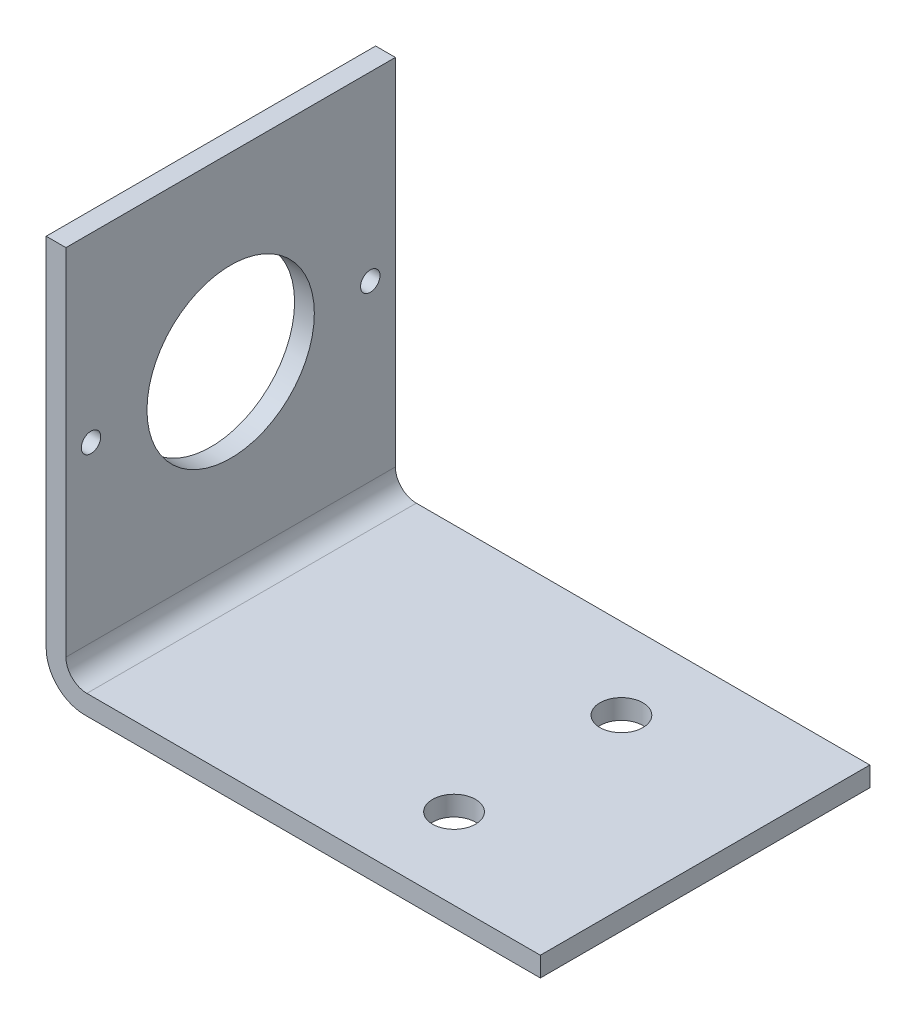
from build123d import *

# Parameters (mm, degrees)
BOSS_EXTRUDE1_DEPTH       = 50
SKETCH5_R                 = 3.2639
MOUNTING_HORIZONTAL_DEPTH = 107.647674169
SKETCH7_R                 = 12.7
BEARING_WITH_MOTOR_DEPTH  = 109.279157861
SKETCH8_R                 = 1.4732
F_4_40_WITH_MOTOR_DEPTH   = 109.279157861


with BuildPart() as part:
    # Sketch2 → Boss-Extrude1 (new body)
    with BuildSketch(Plane.XY):
        with BuildLine():
            Line((0, 5.842), (0, 59.9948))
            Line((0, 59.9948), (2.9972, 59.9948))
            Line((2.9972, 59.9948), (2.9972, 6.1722))
            ThreePointArc((2.9972, 6.1722), (3.92713597, 3.92713597), (6.1722, 2.9972))
            Line((6.1722, 2.9972), (75, 2.9972))
            Line((75, 2.9972), (75, 0))
            Line((75, 0), (5.842, 0))
            ThreePointArc((5.842, 0), (1.711082184, 1.711082184), (0, 5.842))
        make_face()
    extrude(amount=BOSS_EXTRUDE1_DEPTH)

    # Sketch5 → Mounting -- Horizontal (cut, through all)
    with BuildSketch(Plane(origin=(0, 2.9972, 0), x_dir=(1, 0, 0), z_dir=(0, 1, 0))):
        with Locations(Location((49.6, -12.3, 0), (0, 0, 270))):
            Circle(SKETCH5_R)
        with Locations(Location((49.6, -37.7, 0), (0, 0, 270))):
            Circle(SKETCH5_R)
    extrude(amount=-MOUNTING_HORIZONTAL_DEPTH, mode=Mode.SUBTRACT)

    # Sketch7 → Bearing -- With Motor (cut, through all)
    with BuildSketch(Plane.ZY):
        with Locations((25, 32.5)):
            Circle(SKETCH7_R)
    extrude(amount=-BEARING_WITH_MOTOR_DEPTH, mode=Mode.SUBTRACT)

    # Sketch8 → 4-40 -- With Motor (cut, through all)
    with BuildSketch(Plane.ZY):
        with Locations((3.81, 32.5)):
            Circle(SKETCH8_R)
        with Locations((46.19, 32.5)):
            Circle(SKETCH8_R)
    extrude(amount=-F_4_40_WITH_MOTOR_DEPTH, mode=Mode.SUBTRACT)


solid = part.part
